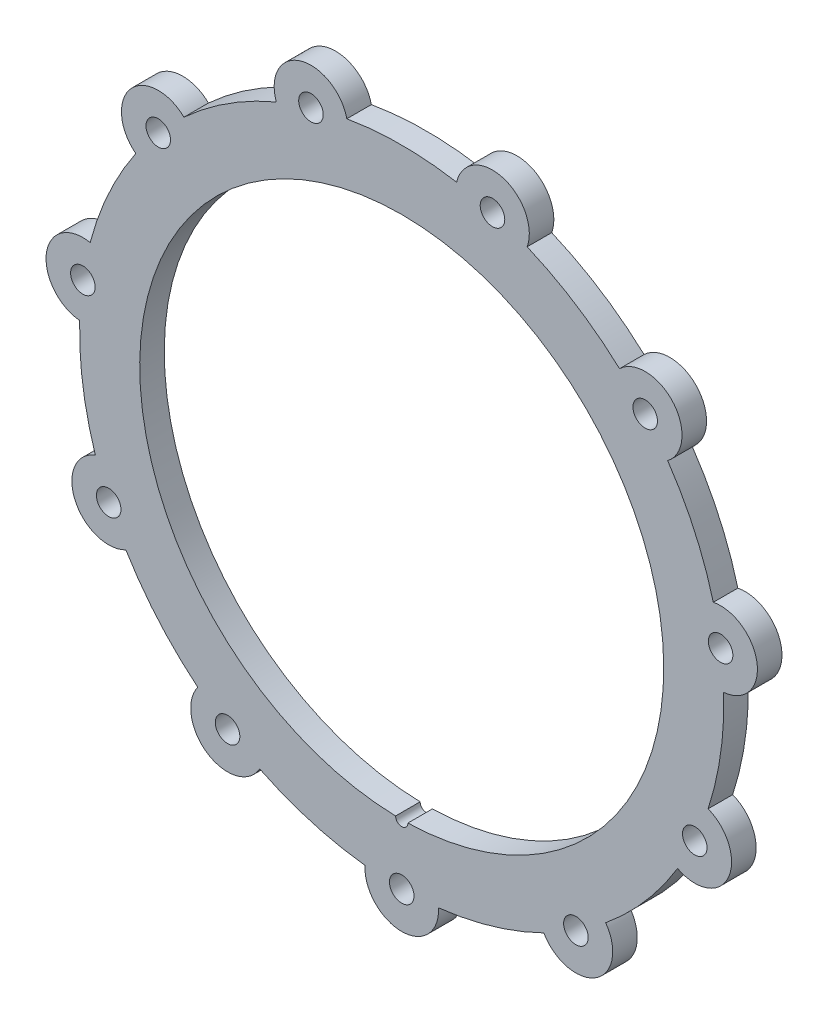
from build123d import *

# Parameters (mm, degrees)
SKETCH_1_R          = 42.7
SKETCH_1_R_2        = 2
EXTRUDE_1_DEPTH     = 4
SKETCH_2_R          = 1
CUT_EXTRUDE_1_DEPTH = 4


with BuildPart() as part:
    # 草图1 → 凸台-拉伸1 (new body)
    with BuildSketch(Plane.XY):
        with BuildLine():
            ThreePointArc((-57.90455435, 8.325418039), (-56.664135325, 3.740040393), (-52.478752132, 1.493510837))
            ThreePointArc((-52.478752132, 1.493510837), (-51.965625699, -7.471529009), (-49.932223308, -16.217986173))
            ThreePointArc((-49.932223308, -16.217986173), (-53.315148558, -19.552674205), (-53.213471728, -24.301778261))
            ThreePointArc((-53.213471728, -24.301778261), (-49.690922522, -27.488622249), (-44.95538855, -27.115734184))
            ThreePointArc((-44.95538855, -27.115734184), (-39.676852654, -34.380188532), (-33.237553958, -40.63883619))
            ThreePointArc((-33.237553958, -40.63883619), (-34.280583312, -45.27310175), (-31.627487821, -49.213331671))
            ThreePointArc((-31.627487821, -49.213331671), (-26.941192918, -49.989841552), (-23.159006743, -47.115925192))
            ThreePointArc((-23.159006743, -47.115925192), (-14.790959234, -50.373381115), (-5.990196072, -52.157142857))
            ThreePointArc((-5.990196072, -52.157142857), (-4.36217508, -56.619639374), (0, -58.5))
            ThreePointArc((0, -58.5), (4.36217508, -56.619639374), (5.990196072, -52.157142857))
            ThreePointArc((5.990196072, -52.157142857), (14.790959234, -50.373381115), (23.159006743, -47.115925192))
            ThreePointArc((23.159006743, -47.115925192), (26.941192918, -49.989841552), (31.627487821, -49.213331671))
            ThreePointArc((31.627487821, -49.213331671), (34.280583312, -45.27310175), (33.237553958, -40.63883619))
            ThreePointArc((33.237553958, -40.63883619), (39.676852654, -34.380188532), (44.95538855, -27.115734184))
            ThreePointArc((44.95538855, -27.115734184), (49.690922522, -27.488622249), (53.213471728, -24.301778261))
            ThreePointArc((53.213471728, -24.301778261), (53.315148558, -19.552674205), (49.932223308, -16.217986173))
            ThreePointArc((49.932223308, -16.217986173), (51.965625699, -7.471529009), (52.478752132, 1.493510837))
            ThreePointArc((52.478752132, 1.493510837), (56.664135325, 3.740040393), (57.90455435, 8.325418039))
            ThreePointArc((57.90455435, 8.325418039), (55.422530843, 12.375589248), (50.773764562, 13.351959864))
            ThreePointArc((50.773764562, 13.351959864), (47.755679756, 21.809288183), (43.34048271, 29.62857672))
            ThreePointArc((43.34048271, 29.62857672), (45.646885531, 33.781266636), (44.2113501, 38.309352936))
            ThreePointArc((44.2113501, 38.309352936), (39.933651182, 40.374690556), (35.494994318, 38.682752984))
            ThreePointArc((35.494994318, 38.682752984), (28.383642916, 44.165810474), (20.441916256, 48.35677884))
            ThreePointArc((20.441916256, 48.35677884), (20.137072107, 53.097179409), (16.481354575, 56.130338956))
            ThreePointArc((16.481354575, 56.130338956), (11.766119429, 55.555112887), (8.946814173, 51.732045351))
            ThreePointArc((8.946814173, 51.732045351), (0, 52.5), (-8.946814173, 51.732045351))
            ThreePointArc((-8.946814173, 51.732045351), (-11.766119429, 55.555112887), (-16.481354575, 56.130338956))
            ThreePointArc((-16.481354575, 56.130338956), (-20.137072107, 53.097179409), (-20.441916256, 48.35677884))
            ThreePointArc((-20.441916256, 48.35677884), (-28.383642916, 44.165810474), (-35.494994318, 38.682752984))
            ThreePointArc((-35.494994318, 38.682752984), (-39.933651182, 40.374690556), (-44.2113501, 38.309352936))
            ThreePointArc((-44.2113501, 38.309352936), (-45.646885531, 33.781266636), (-43.34048271, 29.62857672))
            ThreePointArc((-43.34048271, 29.62857672), (-47.755679756, 21.809288183), (-50.773764562, 13.351959864))
            ThreePointArc((-50.773764562, 13.351959864), (-55.422530843, 12.375589248), (-57.90455435, 8.325418039))
        make_face()
        Circle(SKETCH_1_R, mode=Mode.SUBTRACT)
        with Locations((-51.965625699, 7.471529009)):
            Circle(SKETCH_1_R_2, mode=Mode.SUBTRACT)
        with Locations((-39.676852654, 34.380188532)):
            Circle(SKETCH_1_R_2, mode=Mode.SUBTRACT)
        with Locations((-14.790959234, 50.373381115)):
            Circle(SKETCH_1_R_2, mode=Mode.SUBTRACT)
        with Locations((14.790959234, 50.373381115)):
            Circle(SKETCH_1_R_2, mode=Mode.SUBTRACT)
        with Locations((39.676852654, 34.380188532)):
            Circle(SKETCH_1_R_2, mode=Mode.SUBTRACT)
        with Locations((51.965625699, 7.471529009)):
            Circle(SKETCH_1_R_2, mode=Mode.SUBTRACT)
        with Locations((47.755679756, -21.809288183)):
            Circle(SKETCH_1_R_2, mode=Mode.SUBTRACT)
        with Locations((28.383642916, -44.165810474)):
            Circle(SKETCH_1_R_2, mode=Mode.SUBTRACT)
        with Locations((0, -52.5)):
            Circle(SKETCH_1_R_2, mode=Mode.SUBTRACT)
        with Locations((-28.383642916, -44.165810474)):
            Circle(SKETCH_1_R_2, mode=Mode.SUBTRACT)
        with Locations((-47.755679756, -21.809288183)):
            Circle(SKETCH_1_R_2, mode=Mode.SUBTRACT)
    extrude(amount=EXTRUDE_1_DEPTH)

    # 草图2 → 切除-拉伸1 (cut)
    with BuildSketch(Plane.XY.offset(4)):
        with Locations((0, -42.7)):
            Circle(SKETCH_2_R)
    extrude(amount=-CUT_EXTRUDE_1_DEPTH, mode=Mode.SUBTRACT)


solid = part.part
